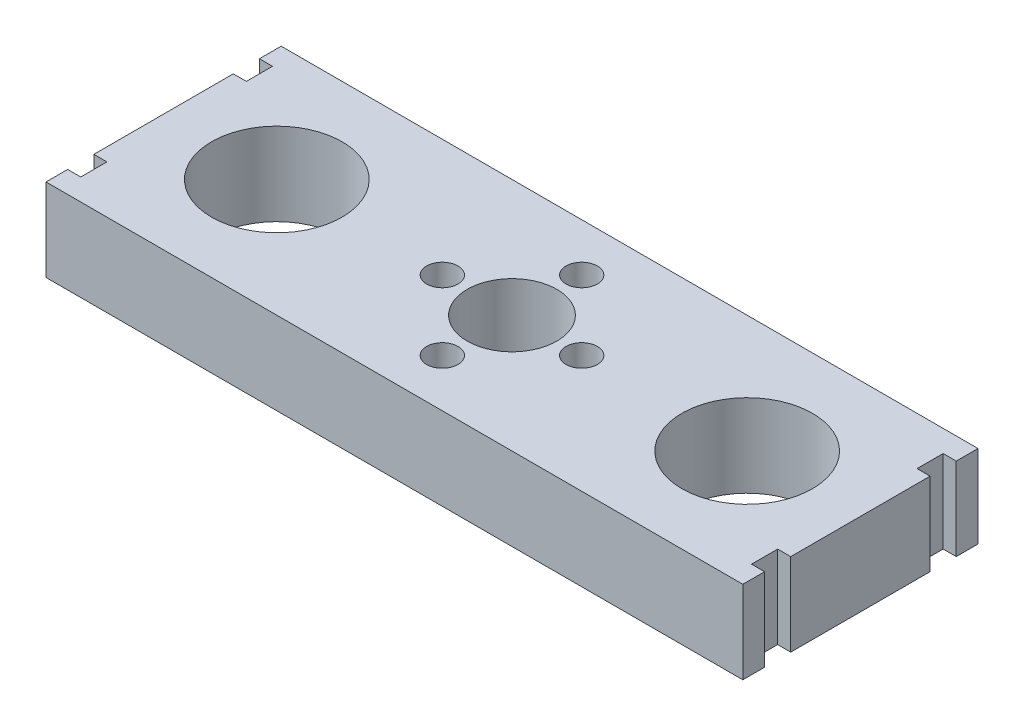
from build123d import *

# Parameters (mm, degrees)
SKETCH_1_W          = 80
SKETCH_1_H          = 27
EXTRUDE_1_DEPTH     = 9.5
SKETCH_3_R          = 7.5
CUT_EXTRUDE_1_DEPTH = 44.272393047
SKETCH_4_R          = 5.15
CUT_EXTRUDE_2_DEPTH = 44.272393047
SKETCH_5_R          = 1.8
CUT_EXTRUDE_3_DEPTH = 44.272393047
SKETCH_7_W          = 1.5
SKETCH_7_H          = 3
CUT_EXTRUDE_4_DEPTH = 44.272393047


with BuildPart() as part:
    # 草图1 → 凸台-拉伸1 (new body)
    with BuildSketch(Plane(origin=(0, 0, 0), x_dir=(1, 0, 0), z_dir=(0, 1, 0))):
        Rectangle(SKETCH_1_W, SKETCH_1_H)
    extrude(amount=EXTRUDE_1_DEPTH)

    # 草图3 → 切除-拉伸1 (cut, through all)
    with BuildSketch(Plane(origin=(0, 9.5, 0), x_dir=(1, 0, 0), z_dir=(0, 1, 0))):
        with Locations(Location((-27, 0, 0), (0, 0, 270))):
            Circle(SKETCH_3_R)
        with Locations(Location((27, 0, 0), (0, 0, 270))):
            Circle(SKETCH_3_R)
    extrude(amount=-CUT_EXTRUDE_1_DEPTH, mode=Mode.SUBTRACT)

    # 草图4 → 切除-拉伸2 (cut, through all)
    with BuildSketch(Plane(origin=(0, 9.5, 0), x_dir=(1, 0, 0), z_dir=(0, 1, 0))):
        with Locations(Location((0, 0, 0), (0, 0, 270))):
            Circle(SKETCH_4_R)
    extrude(amount=-CUT_EXTRUDE_2_DEPTH, mode=Mode.SUBTRACT)

    # 草图5 → 切除-拉伸3 (cut, through all)
    with BuildSketch(Plane(origin=(0, 9.5, 0), x_dir=(1, 0, 0), z_dir=(0, 1, 0))):
        with Locations(Location((8, 0, 0), (0, 0, 270))):
            Circle(SKETCH_5_R)
        with Locations(Location((-8, 0, 0), (0, 0, 270))):
            Circle(SKETCH_5_R)
        with Locations(Location((0, 8, 0), (0, 0, 270))):
            Circle(SKETCH_5_R)
        with Locations(Location((0, -8, 0), (0, 0, 270))):
            Circle(SKETCH_5_R)
    extrude(amount=-CUT_EXTRUDE_3_DEPTH, mode=Mode.SUBTRACT)

    # 草图7 → 切除-拉伸4 (cut, through all)
    with BuildSketch(Plane(origin=(0, 9.5, 0), x_dir=(1, 0, 0), z_dir=(0, 1, 0))):
        with Locations((39.25, 9.501563289)):
            Rectangle(SKETCH_7_W, SKETCH_7_H)
        with Locations((39.25, -9.49986112)):
            Rectangle(SKETCH_7_W, SKETCH_7_H)
        with Locations((-39.25, 9.501563289)):
            Rectangle(SKETCH_7_W, SKETCH_7_H)
        with Locations((-39.25, -9.506798333)):
            Rectangle(SKETCH_7_W, SKETCH_7_H)
    extrude(amount=-CUT_EXTRUDE_4_DEPTH, mode=Mode.SUBTRACT)


solid = part.part
